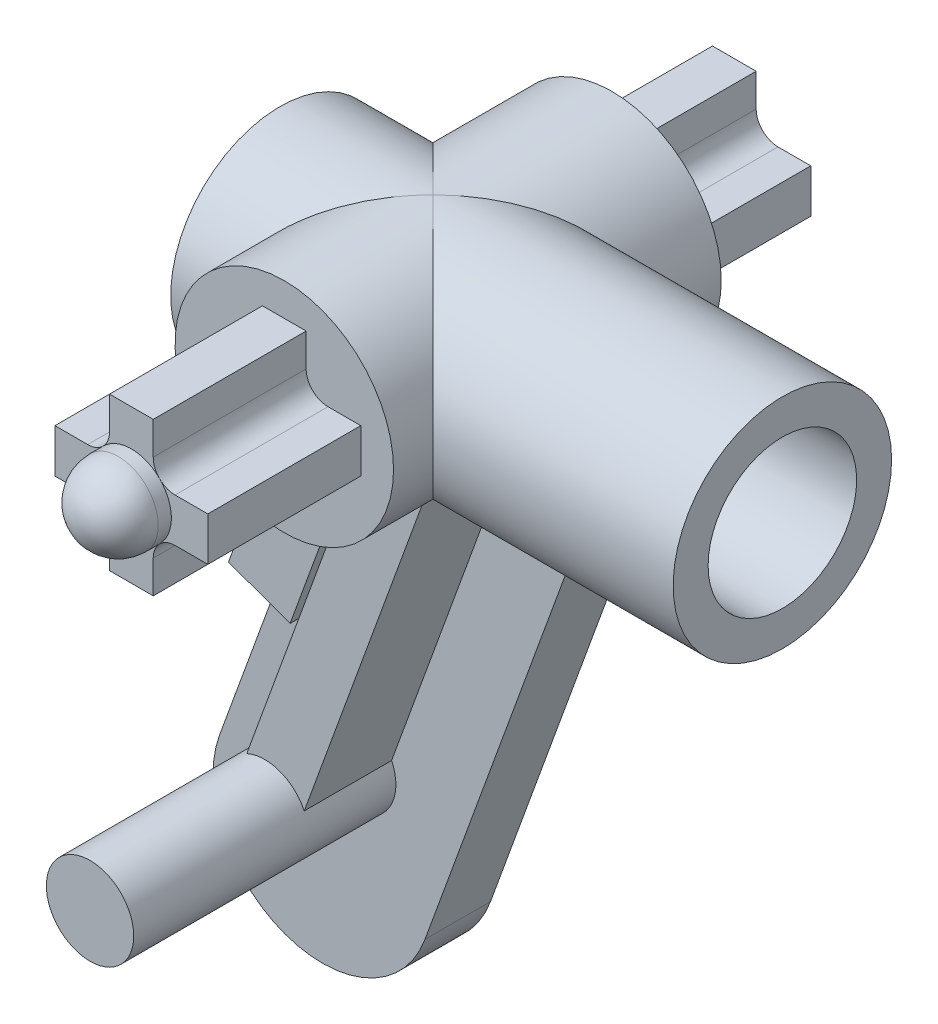
from build123d import *

# Parameters (mm, degrees)
ESTRUSIONE_ESTRUSIONE1_DEPTH  = 1.5
SCHIZZO2_R                    = 2.5
ESTRUSIONE_ESTRUSIONE2_DEPTH  = 7.5
SCHIZZO3_R                    = 1
ESTRUSIONE_ESTRUSIONE3_DEPTH  = 6
SCHIZZO4_R                    = 2.5
ESTRUSIONE_ESTRUSIONE8_DEPTH  = 8
ESTRUSIONE_ESTRUSIONE16_START = -3.5
SCHIZZO5_R                    = 2.5
ESTRUSIONE_ESTRUSIONE16_DEPTH = 3.5
SCHIZZO7_W                    = 1
SCHIZZO7_H                    = 3.5
SCHIZZO7_W_2                  = 3.5
SCHIZZO7_H_2                  = 1
ESTRUSIONE_SOTTILE1_DEPTH     = 3.5
RACCORDO1_R                   = 0.5
RACCORDO1_OF_SPECCHIA6_R      = 0.5
SCHIZZO10_R                   = 0.914213562
ESTRUSIONE_ESTRUSIONE17_DEPTH = 0.3
ESTRUSIONE_ESTRUSIONE18_DEPTH = 2.2
ESTRUSIONE_ESTRUSIONE19_DEPTH = 2
FORO_PER_VITE_M3_1_D          = 3.4


with BuildPart() as part:
    # Schizzo1 → Estrusione-Estrusione1 (new body)
    with BuildSketch(Plane.XY):
        with BuildLine():
            Line((2.349231552, -0.855050358), (-2.781070598, -14.95043967))
            ThreePointArc((-2.781070598, -14.95043967), (-5.985352508, -16.444620864), (-7.479533702, -13.240338953))
            Line((-7.479533702, -13.240338953), (-2.349231552, 0.855050358))
            ThreePointArc((-2.349231552, 0.855050358), (0.855050358, 2.349231552), (2.349231552, -0.855050358))
        make_face()
    extrude(amount=ESTRUSIONE_ESTRUSIONE1_DEPTH)

    # Schizzo2 → Estrusione-Estrusione2 (add)
    with BuildSketch(Plane.XY):
        with Locations(Location((0, 0, 0), (0, 0, 160))):
            Circle(SCHIZZO2_R)
    extrude(amount=ESTRUSIONE_ESTRUSIONE2_DEPTH)

    # Schizzo3 → Estrusione-Estrusione3 (add)
    with BuildSketch(Plane.XY.offset(1.5)):
        with Locations((-4.446261863, -12.21600407)):
            Circle(SCHIZZO3_R)
    extrude(amount=ESTRUSIONE_ESTRUSIONE3_DEPTH)

    # Schizzo4 → Estrusione-Estrusione8 (add)
    with BuildSketch(Plane(origin=(0, 0, 0), x_dir=(0, 0, -1), z_dir=(1, 0, 0))):
        with Locations(Location((-4.1, 0, 0), (0, 0, 270))):
            Circle(SCHIZZO4_R)
    extrude(amount=ESTRUSIONE_ESTRUSIONE8_DEPTH)

    # Schizzo5 → Estrusione-Estrusione16 (add)
    with BuildSketch(Plane(origin=(0, 0, 0), x_dir=(0, 0, -1), z_dir=(1, 0, 0)).offset(ESTRUSIONE_ESTRUSIONE16_START)):
        with Locations(Location((-4.1, 0, 0), (0, 0, 270))):
            Circle(SCHIZZO5_R)
    extrude(amount=ESTRUSIONE_ESTRUSIONE16_DEPTH)

    # Schizzo7 → Estrusione-Sottile1 (add)
    with BuildSketch(Plane.XY.offset(7.5)):
        Rectangle(SCHIZZO7_W, SCHIZZO7_H)
        Rectangle(SCHIZZO7_W_2, SCHIZZO7_H_2)
    estrusione_sottile1 = extrude(amount=ESTRUSIONE_SOTTILE1_DEPTH)

    # Raccordo1
    raccordo1_edges = [part.edges().sort_by_distance(p)[0] for p in [
        (-0.5, 0.5, 9.25),
        (0.5, -0.5, 9.25),
        (-0.5, -0.5, 9.25),
        (0.5, 0.5, 9.25),
    ]]
    fillet(raccordo1_edges, radius=RACCORDO1_R)

    # Specchia6: Estrusione-Sottile1 across plane
    add(estrusione_sottile1.mirror(Plane.XY.offset(4.1)))

    # Raccordo1 of Specchia6
    raccordo1_of_specchia6_edges = [part.edges().sort_by_distance(p)[0] for p in [
        (-0.5, 0.5, -1.05),
        (0.5, -0.5, -1.05),
        (-0.5, -0.5, -1.05),
        (0.5, 0.5, -1.05),
    ]]
    fillet(raccordo1_of_specchia6_edges, radius=RACCORDO1_OF_SPECCHIA6_R)

    # Schizzo10 → Estrusione-Estrusione17 (add)
    with BuildSketch(Plane.XY.offset(11)):
        with Locations(Location((0, 0, 0), (0, 0, 135))):
            Circle(SCHIZZO10_R)
    extrude(amount=ESTRUSIONE_ESTRUSIONE17_DEPTH)

    # Schizzo11 → Rivoluzione2 (revolve)
    with BuildSketch(Plane.XY.offset(11.3)):
        with BuildLine():
            Line((-0.914213562, 0), (0.914213562, 0))
            ThreePointArc((0.914213562, 0), (0, 0.914213562), (-0.914213562, 0))
        make_face()
    revolve(axis=Axis((-0.914213562, 0, 11.3), (1, 0, 0)))

    # Schizzo12 → Estrusione-Estrusione18 (add)
    with BuildSketch(Plane.XY.offset(1.5)):
        Polygon((-5.077352246, -7.517540966), (-2.341191099, 0), (-0.931652168, -0.513030215), (-3.667813315, -8.030571181), align=None)
    extrude(amount=ESTRUSIONE_ESTRUSIONE18_DEPTH)

    # Schizzo13 → Estrusione-Estrusione19 (add)
    with BuildSketch(Plane.XY.offset(1.5)):
        Polygon((-3.788477029, -12.455418171), (0.744924441, 0), (-0.744924441, 0), (-5.104046698, -11.97658997), align=None)
    extrude(amount=ESTRUSIONE_ESTRUSIONE19_DEPTH)

    # Foro per Vite M3-1 (through all)
    with Locations(Plane(origin=(-3.5, 0, 4.1), x_dir=(0, 0, -1), z_dir=(-1, 0, 0))):
        with Locations((0, 0)):
            Hole(FORO_PER_VITE_M3_1_D / 2)


solid = part.part
